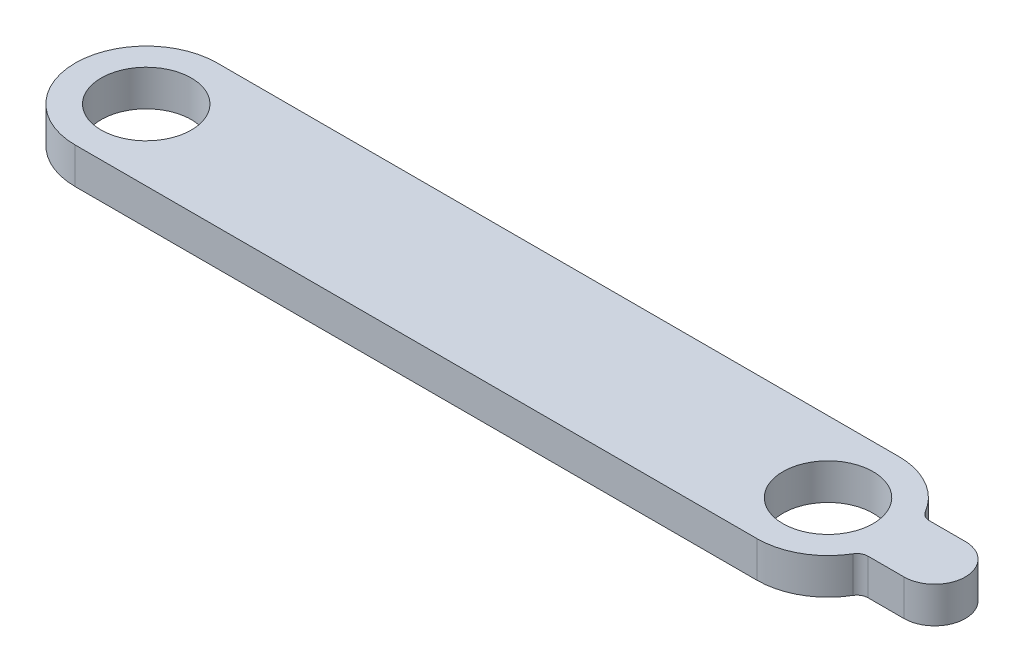
from build123d import *

# Parameters (mm, degrees)
SKETCH1_R           = 3.96875
BOSS_EXTRUDE1_DEPTH = 3.175


with BuildPart() as part:
    # Sketch1 → Boss-Extrude1 (new body)
    with BuildSketch(Plane(origin=(0, 0, 0), x_dir=(1, 0, 0), z_dir=(0, 1, 0))):
        with BuildLine():
            Line((-30.06597498, 6.287799421), (29.93402502, 6.287799421))
            ThreePointArc((29.93402502, 6.287799421), (33.02652847, 5.469090466), (35.308836634, 3.227454594))
            ThreePointArc((35.308836634, 3.227454594), (35.67400594, 2.868792854), (36.168806492, 2.737799421))
            Line((36.168806492, 2.737799421), (39.323343513, 2.737799421))
            ThreePointArc((39.323343513, 2.737799421), (42.023343513, 0.037799421), (39.323343513, -2.662200579))
            Line((39.323343513, -2.662200579), (36.168806492, -2.662200579))
            ThreePointArc((36.168806492, -2.662200579), (35.67400594, -2.793194011), (35.308836634, -3.151855751))
            ThreePointArc((35.308836634, -3.151855751), (33.02652847, -5.393491623), (29.93402502, -6.212200579))
            Line((29.93402502, -6.212200579), (-30.06597498, -6.212200579))
            ThreePointArc((-30.06597498, -6.212200579), (-36.31597498, 0.037799421), (-30.06597498, 6.287799421))
        make_face()
        with Locations(Location((-30.06597498, 0.037799421, 0), (0, 0, 270))):
            Circle(SKETCH1_R, mode=Mode.SUBTRACT)
        with Locations(Location((29.93402502, 0.037799421, 0), (0, 0, 270))):
            Circle(SKETCH1_R, mode=Mode.SUBTRACT)
    extrude(amount=BOSS_EXTRUDE1_DEPTH)


solid = part.part
